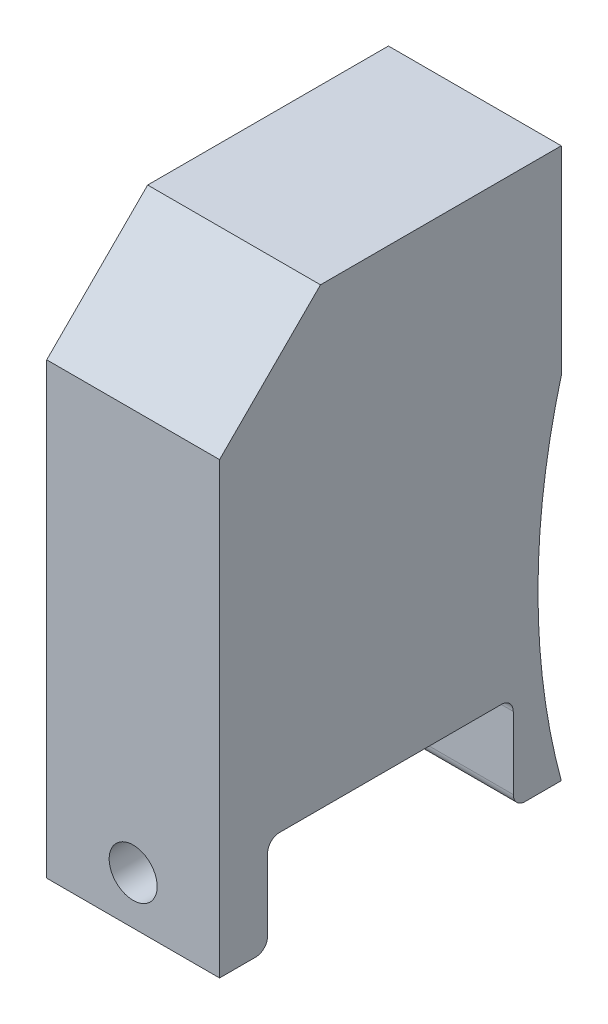
from build123d import *

# Parameters (mm, degrees)
BOSS_EXTRUDE1_DEPTH     = 72
SKETCH4_R               = 19.05
CUT_EXTRUDE1_DEPTH      = 15
CUT_EXTRUDE2_DEPTH      = 280.154292263
CUT_EXTRUDE2_DEPTH_BACK = 72
FILLET2_R               = 5
FILLET3_R               = 5
SKETCH7_R               = 10
CUT_EXTRUDE3_DEPTH      = 20
CUT_EXTRUDE4_START      = -20
SKETCH8_R               = 10
CUT_EXTRUDE4_DEPTH      = 20
CUT_EXTRUDE5_DEPTH      = 62
CUT_EXTRUDE5_DEPTH_BACK = 266.891664466


with BuildPart() as part:
    # Sketch3 → Boss-Extrude1 (new body)
    with BuildSketch(Plane(origin=(0, 0, 0), x_dir=(0, 0, -1), z_dir=(1, 0, 0))):
        with BuildLine():
            Line((0, 0), (-100.313440323, 0))
            Line((-100.313440323, 0), (-142.357474116, -42.044033793))
            Line((-142.357474116, -42.044033793), (-142.357474116, -229.079611603))
            Line((-142.357474116, -229.079611603), (0, -229.079611603))
            ThreePointArc((0, -229.079611603), (-9.701802008, -156.011943225), (0, -82.944274847))
            Line((0, -82.944274847), (0, 0))
        make_face()
    extrude(amount=BOSS_EXTRUDE1_DEPTH)

    # Sketch4 → Cut-Extrude1 (cut)
    with BuildSketch(Plane(origin=(0, 0, 0), x_dir=(-1, 0, 0), z_dir=(0, 0, -1))):
        with Locations((-36, -41.472137424)):
            Circle(SKETCH4_R)
    extrude(amount=-CUT_EXTRUDE1_DEPTH, mode=Mode.SUBTRACT)

    # Sketch6 → Cut-Extrude2 (cut, two sides: drawn at the far end of the back side and taken through both)
    with BuildSketch(Plane.ZY.offset(-CUT_EXTRUDE2_DEPTH_BACK)):
        with BuildLine():
            Line((20, -194.079611603), (20, -229.079611603))
            Line((20, -229.079611603), (122.357474116, -229.079611603))
            Line((122.357474116, -229.079611603), (122.357474116, -194.079611603))
            ThreePointArc((122.357474116, -194.079611603), (120.893008022, -190.544077697), (117.357474116, -189.079611603))
            Line((117.357474116, -189.079611603), (25, -189.079611603))
            ThreePointArc((25, -189.079611603), (21.464466094, -190.544077697), (20, -194.079611603))
        make_face()
    extrude(amount=CUT_EXTRUDE2_DEPTH + CUT_EXTRUDE2_DEPTH_BACK, mode=Mode.SUBTRACT)

    # Fillet2
    fillet2_edges = [part.edges().sort_by_distance(p)[0] for p in [
        (36, -229.079611603, 122.357474116),
    ]]
    fillet(fillet2_edges, radius=FILLET2_R)

    # Fillet3
    fillet3_edges = [part.edges().sort_by_distance(p)[0] for p in [
        (36, -229.079611603, 20),
    ]]
    fillet(fillet3_edges, radius=FILLET3_R)

    # Sketch7 → Cut-Extrude3 (cut)
    with BuildSketch(Plane.XY.offset(20)):
        with Locations((36, -209.079611603)):
            Circle(SKETCH7_R)
    extrude(amount=-CUT_EXTRUDE3_DEPTH, mode=Mode.SUBTRACT)

    # Sketch8 → Cut-Extrude4 (cut)
    with BuildSketch(Plane(origin=(0, 0, 122.357474116), x_dir=(-1, 0, 0), z_dir=(0, 0, -1)).offset(CUT_EXTRUDE4_START)):
        with Locations(Location((-36, -209.079611603, 0), (0, 0, 180))):
            Circle(SKETCH8_R)
    extrude(amount=CUT_EXTRUDE4_DEPTH, mode=Mode.SUBTRACT)

    # 3DSketch1 → Cut-Extrude5 (cut, two sides: drawn at the far end of the back side and taken through both)
    with BuildSketch(Plane(origin=(0, -10, 10), x_dir=(0, -0.8328059611361112, 0.5535650197548234), z_dir=(1, 0, 0)).offset(-CUT_EXTRUDE5_DEPTH_BACK)):
        with BuildLine():
            Line((0, 0), (59.645268452, 39.646130972))
            add(Edge.make_bspline(
                [(59.645268452, 39.646130972), (59.851795376, 39.715600731), (60.058269091, 39.785227228), (60.264675078, 39.855053234), (63.229785209, 40.86201534), (66.17490971, 41.927849195), (68.900213672, 42.962126659), (76.587988483, 45.990190363), (84.19497116, 49.226232383), (89.073273504, 51.419920765), (100.476332318, 56.870903082), (111.513798328, 63.017783233), (117.769927201, 66.769037831), (127.427935538, 72.935642789), (136.853699774, 79.471867671), (140.230773606, 81.904573636), (143.55059138, 84.409472242), (146.799821395, 86.998315475)],
                knots=[0, 0, 0, 0, 0, 0, 0.010941255, 0.010941255, 0.010941255, 0.157238463, 0.157238463, 0.157238463, 0.425526751, 0.425526751, 0.425526751, 0.791499989, 0.791499989, 0.791499989, 1, 1, 1, 1, 1, 1], degree=5))
            add(Edge.make_bspline(
                [(146.799821395, 86.998315475), (146.838080386, 86.762713184), (146.881107812, 86.527938496), (146.928924899, 86.294146385), (147.096403086, 85.553769019), (147.312816425, 84.826481066), (147.482240174, 84.333957214), (147.795805007, 83.524872282), (148.156499747, 82.733389058), (148.30986597, 82.422264084), (148.555972143, 81.967326058), (148.831974102, 81.531039473), (148.925540772, 81.387965286), (149.020186904, 81.245580943), (149.114830616, 81.103195054), (149.115042333, 81.102876537)],
                knots=[0, 0, 0, 0, 0, 0, 0.186963411, 0.186963411, 0.186963411, 0.594974268, 0.594974268, 0.594974268, 0.865886461, 0.865886461, 0.865886461, 0.999699989, 1, 1, 1, 1, 1, 1], degree=5))
            Line((149.115042333, 81.102876537), (200.239850729, 4.188614121))
            add(Edge.make_bspline(
                [(200.239850729, 4.188614121), (200.33660104, 4.043058978), (200.433351351, 3.897503835), (200.531212292, 3.752716424), (200.831458899, 3.322960579), (201.161692533, 2.913933484), (201.392598415, 2.649392187), (201.990294831, 2.005724158), (202.622961514, 1.399585759), (203.015866658, 1.051305446), (203.829718887, 0.389334387), (204.702518346, -0.195889299), (205.152045635, -0.468884344), (206.074136833, -0.974780932), (207.035864281, -1.398770698), (207.525516965, -1.589737739), (208.520160048, -1.92851386), (209.540998156, -2.178769515), (210.056594039, -2.281493418), (211.095395611, -2.441585761), (212.14392909, -2.509871945), (212.669382635, -2.521145098), (213.720170989, -2.498114724), (214.765737187, -2.384257389), (215.285564899, -2.304395964), (216.311894633, -2.099178413), (217.313403497, -1.80116732), (217.805927348, -1.631743571), (218.615012281, -1.318178739), (219.406495505, -0.957483999), (219.717620478, -0.804117776), (220.172558504, -0.558011603), (220.608521923, -0.282214084), (220.751280697, -0.188863989), (220.89334807, -0.094431995), (221.035415443, 0)],
                knots=[0, 0, 0, 0, 0, 0, 0.037135909, 0.037135909, 0.037135909, 0.111407726, 0.111407726, 0.111407726, 0.222815452, 0.222815452, 0.222815452, 0.334223178, 0.334223178, 0.334223178, 0.445630904, 0.445630904, 0.445630904, 0.55703863, 0.55703863, 0.55703863, 0.668446357, 0.668446357, 0.668446357, 0.779854083, 0.779854083, 0.779854083, 0.890371964, 0.890371964, 0.890371964, 0.963753936, 0.963753936, 0.963753936, 1, 1, 1, 1, 1, 1], degree=5))
            Line((221.035415443, 0), (97.868875178, -81.868636245))
            Line((97.868875178, -81.868636245), (47.701419988, -71.763976232))
            Line((47.701419988, -71.763976232), (0, 0))
        make_face()
    extrude(amount=CUT_EXTRUDE5_DEPTH + CUT_EXTRUDE5_DEPTH_BACK, mode=Mode.SUBTRACT)


solid = part.part
